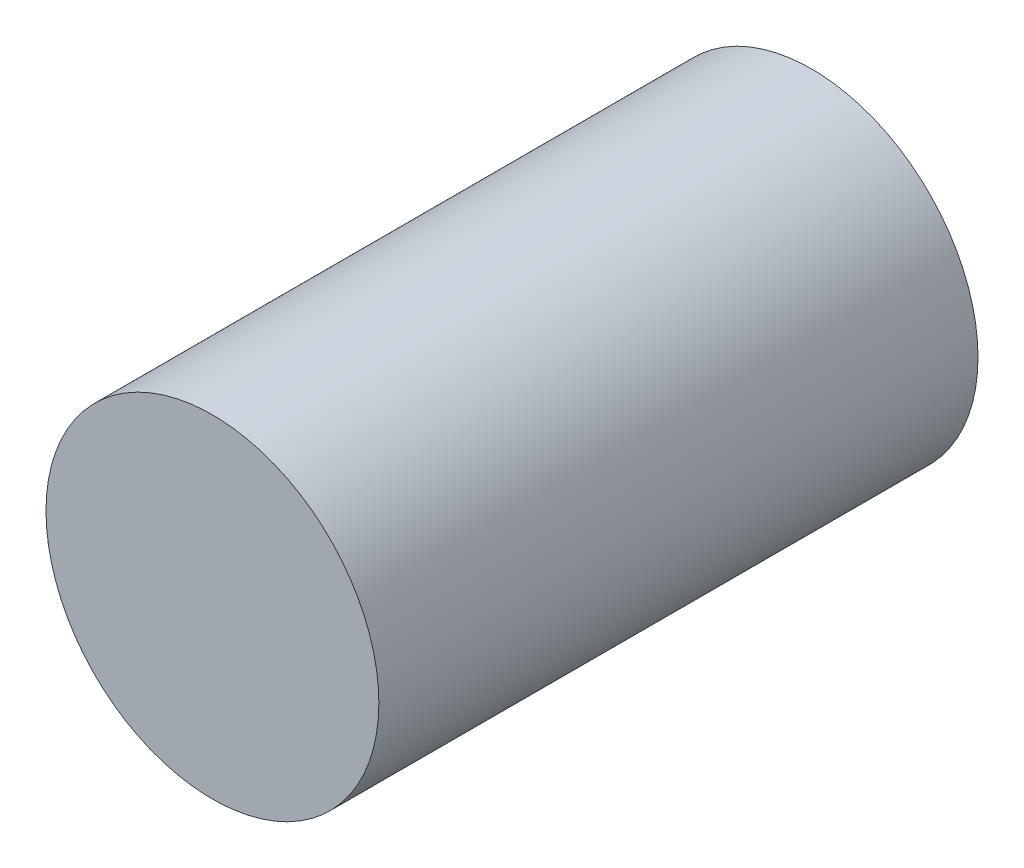
from build123d import *

# Parameters (mm, degrees)
SKETCH1_R           = 3.175
BOSS_EXTRUDE1_DEPTH = 11.43


with BuildPart() as part:
    # Sketch1 → Boss-Extrude1 (new body)
    with BuildSketch(Plane.XY):
        Circle(SKETCH1_R)
    extrude(amount=BOSS_EXTRUDE1_DEPTH)


solid = part.part
